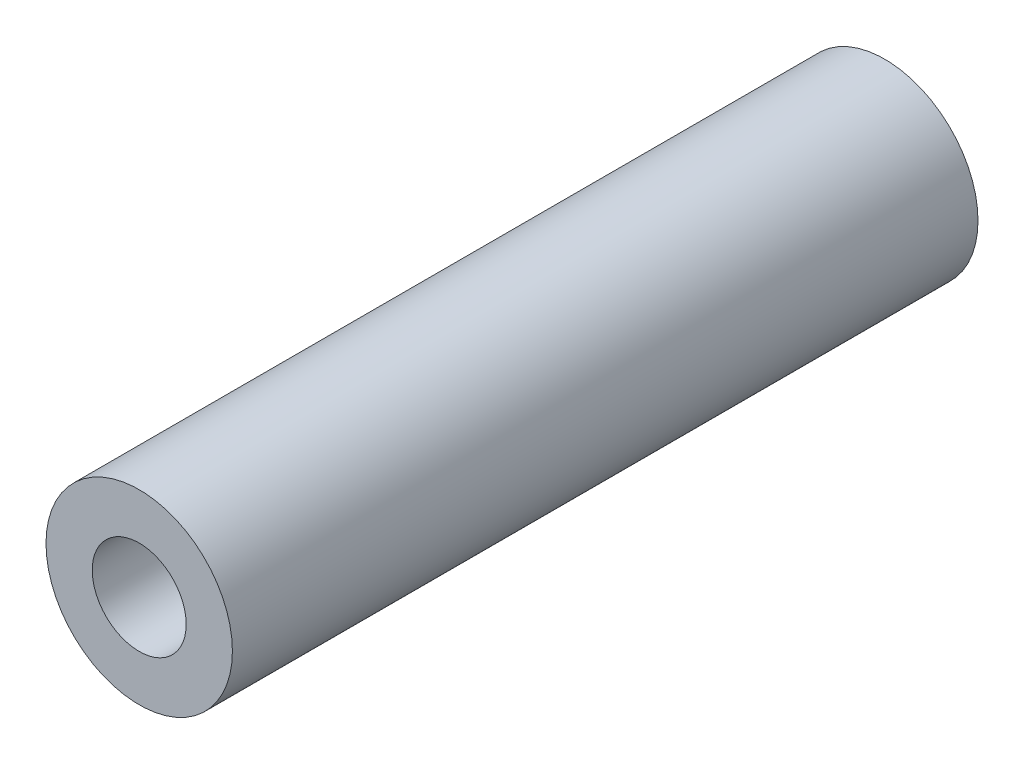
from build123d import *

# Parameters (mm, degrees)
SKETCH1_R      = 6.35
SKETCH1_R_2    = 3.2004
EXTRUDE1_DEPTH = 25.4


with BuildPart() as part:
    # Sketch1 → Extrude1 (new, symmetric)
    with BuildSketch(Plane.XY):
        Circle(SKETCH1_R)
        Circle(SKETCH1_R_2, mode=Mode.SUBTRACT)
    extrude(amount=EXTRUDE1_DEPTH, both=True)


solid = part.part
